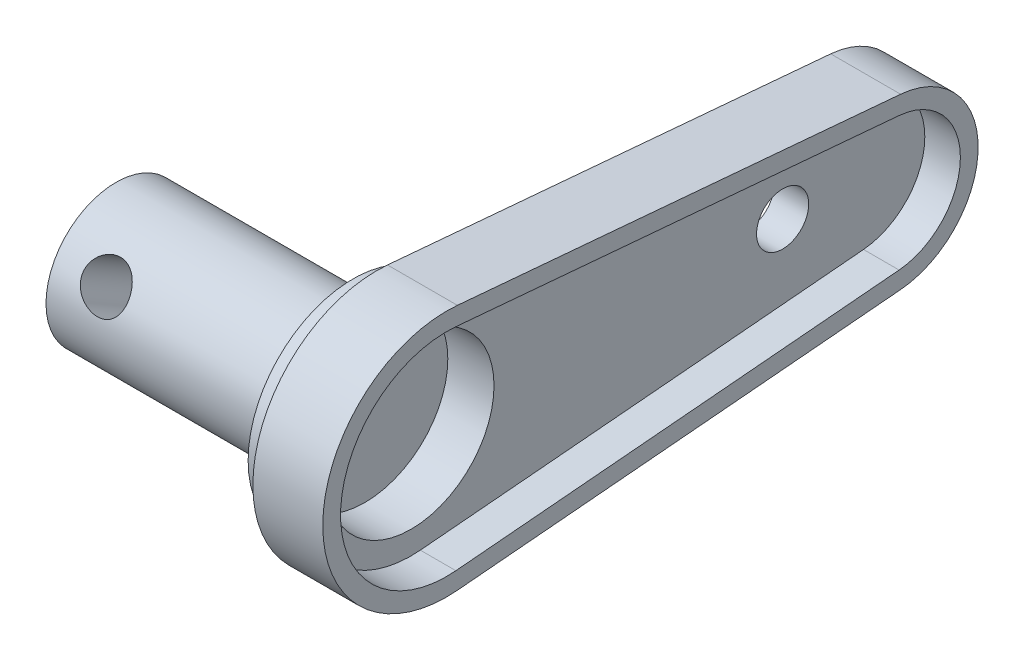
from build123d import *

# Parameters (mm, degrees)
BOSS_EXTRUDE1_DEPTH = 2.9972
SKETCH2_R           = 3
BOSS_EXTRUDE2_DEPTH = 11.176
SKETCH3_R           = 4.4958
BOSS_EXTRUDE3_DEPTH = 1.016
CUT_EXTRUDE1_DEPTH  = 1.524
SKETCH5_R           = 3.556
CUT_EXTRUDE2_DEPTH  = 1.9812
SKETCH6_R           = 1.1176
CUT_EXTRUDE3_DEPTH  = 32.262860272
SKETCH9_R           = 0.9906
CUT_EXTRUDE4_DEPTH  = 10.16


with BuildPart() as part:
    # Sketch1 → Boss-Extrude1 (new body)
    with BuildSketch(Plane(origin=(0, 0, 0), x_dir=(0, 0, -1), z_dir=(1, 0, 0))):
        with BuildLine():
            Line((24.769539012, 3.626266444), (5.771274976, 5.288399174))
            ThreePointArc((5.771274976, 5.288399174), (0, 0), (5.771274976, -5.288399174))
            Line((5.771274976, -5.288399174), (24.769539012, -3.626266444))
            ThreePointArc((24.769539012, -3.626266444), (28.0924, 0), (24.769539012, 3.626266444))
        make_face()
    extrude(amount=BOSS_EXTRUDE1_DEPTH)

    # Sketch2 → Boss-Extrude2 (add)
    with BuildSketch(Plane.ZY):
        with Locations(Location((-5.3086, 0, 0), (0, 0, 180))):
            Circle(SKETCH2_R)
    extrude(amount=BOSS_EXTRUDE2_DEPTH)

    # Sketch3 → Boss-Extrude3 (add)
    with BuildSketch(Plane.ZY):
        with Locations(Location((-5.3086, 0, 0), (0, 0, 180))):
            Circle(SKETCH3_R)
    extrude(amount=BOSS_EXTRUDE3_DEPTH)

    # Sketch4 → Cut-Extrude1 (cut)
    with BuildSketch(Plane(origin=(2.9972, 0, 0), x_dir=(0, 0, -1), z_dir=(1, 0, 0))):
        with BuildLine():
            Line((24.703126336, 2.867166085), (5.7048623, 4.529298814))
            ThreePointArc((5.7048623, 4.529298814), (0.762, 0), (5.7048623, -4.529298814))
            Line((5.7048623, -4.529298814), (24.703126336, -2.867166085))
            ThreePointArc((24.703126336, -2.867166085), (27.3304, 0), (24.703126336, 2.867166085))
        make_face()
    extrude(amount=-CUT_EXTRUDE1_DEPTH, mode=Mode.SUBTRACT)

    # Sketch5 → Cut-Extrude2 (cut)
    with BuildSketch(Plane(origin=(1.4732, 0, 0), x_dir=(0, 0, -1), z_dir=(1, 0, 0))):
        with Locations((5.3086, 0)):
            Circle(SKETCH5_R)
    extrude(amount=-CUT_EXTRUDE2_DEPTH, mode=Mode.SUBTRACT)

    # Sketch6 → Cut-Extrude3 (cut, through all)
    with BuildSketch(Plane(origin=(1.4732, 0, 0), x_dir=(0, 0, -1), z_dir=(1, 0, 0))):
        with Locations((21.2344, 0)):
            Circle(SKETCH6_R)
    extrude(amount=-CUT_EXTRUDE3_DEPTH, mode=Mode.SUBTRACT)

    # Sketch9 → Cut-Extrude4 (cut)
    with BuildSketch(Plane(origin=(0, -4.097011229, -7.096231608), x_dir=(-1, 0, 0), z_dir=(0, -0.500000000000004, -0.8660254037844363))):
        with Locations(Location((9.022814295, 2.6543, 0), (0, 0, 90))):
            Circle(SKETCH9_R)
    extrude(amount=-CUT_EXTRUDE4_DEPTH, mode=Mode.SUBTRACT)


solid = part.part
